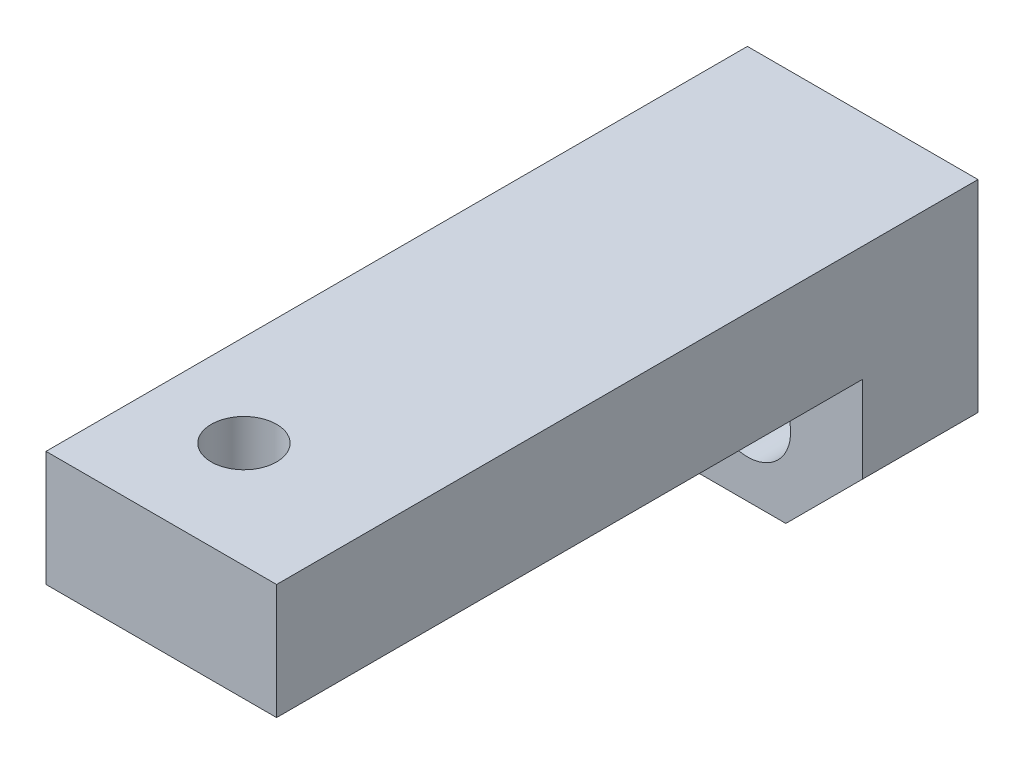
from build123d import *

# Parameters (mm, degrees)
SKETCH1_W                      = 36.5
SKETCH1_H                      = 14.5
BOSS_EXTRUDE1_DEPTH            = 12
SKETCH2_W                      = 30.5
SKETCH2_H                      = 8.5
CUT_EXTRUDE1_DEPTH             = 42.067018397
F_4_5_4_5_DIAMETER_HOLE1_D     = 4.5
F_4_5_4_5_DIAMETER_HOLE1_DEPTH = 36.5
F_3_4_3_4_DIAMETER_HOLE1_D     = 3.4
F_3_4_3_4_DIAMETER_HOLE1_DEPTH = 14.5
CHAMFER1_SIZE                  = 4


with BuildPart() as part:
    # Sketch1 → Boss-Extrude1 (new body)
    with BuildSketch(Plane(origin=(7.22, 0, 0), x_dir=(0, 0, -1), z_dir=(1, 0, 0))):
        with Locations((-18.25, -7.25)):
            Rectangle(SKETCH1_W, SKETCH1_H)
    extrude(amount=-BOSS_EXTRUDE1_DEPTH)

    # Sketch2 → Cut-Extrude1 (cut, through all)
    with BuildSketch(Plane.ZY.offset(4.78)):
        with Locations((21.25, -10.25)):
            Rectangle(SKETCH2_W, SKETCH2_H)
    extrude(amount=-CUT_EXTRUDE1_DEPTH, mode=Mode.SUBTRACT)

    # Ø4.5 (4.5) Diameter Hole1
    with Locations(Plane(origin=(0, 0, 0), x_dir=(-1, 0, 0), z_dir=(0, 0, -1))):
        with Locations((-1.22, -10.25)):
            Hole(F_4_5_4_5_DIAMETER_HOLE1_D / 2, depth=F_4_5_4_5_DIAMETER_HOLE1_DEPTH)

    # Ø3.4 (3.4) Diameter Hole1
    with Locations(Plane(origin=(0, 0, 0), x_dir=(1, 0, 0), z_dir=(0, 1, 0))):
        with Locations((0, -30.98)):
            Hole(F_3_4_3_4_DIAMETER_HOLE1_D / 2, depth=F_3_4_3_4_DIAMETER_HOLE1_DEPTH)

    # Chamfer1
    chamfer1_edges = [part.edges().sort_by_distance(p)[0] for p in [
        (7.22, -14.5, 3),
    ]]
    chamfer(chamfer1_edges, length=CHAMFER1_SIZE)


solid = part.part
